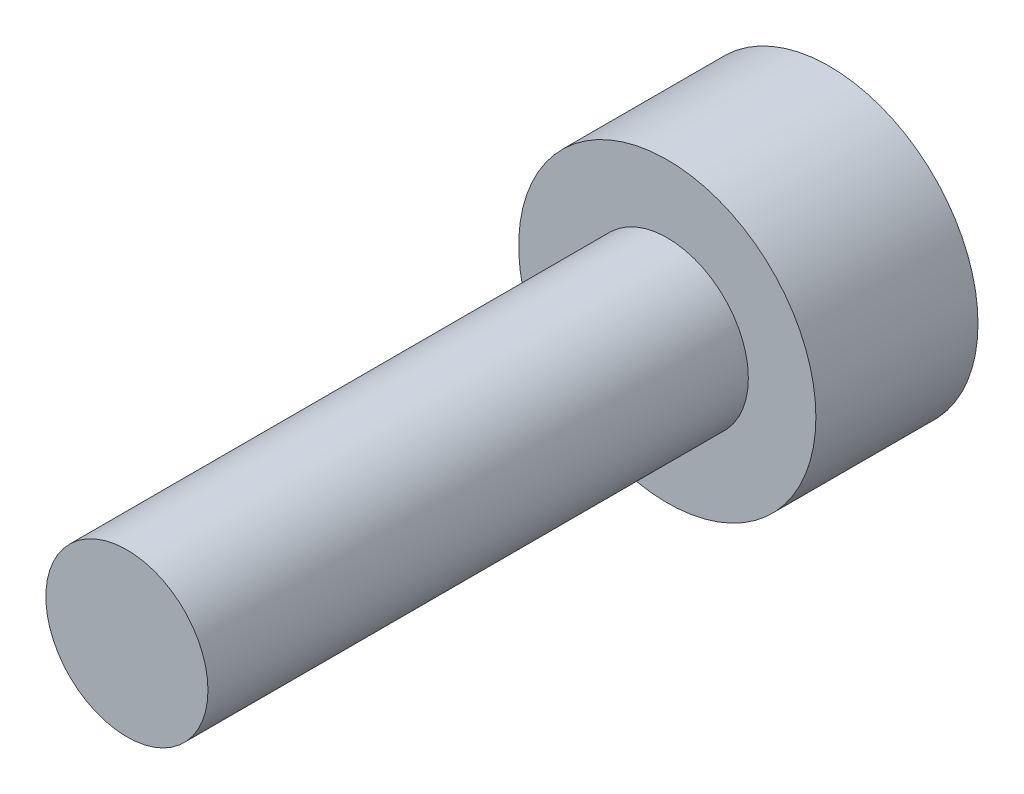
from build123d import *

# Parameters (mm, degrees)
SKETCH_1_R      = 2.75
EXTRUDE_1_DEPTH = 3
SKETCH_2_R      = 1.5
EXTRUDE_2_DEPTH = 10


with BuildPart() as part:
    # 草图1 → 凸台-拉伸1 (new body)
    with BuildSketch(Plane.XY):
        Circle(SKETCH_1_R)
    extrude(amount=EXTRUDE_1_DEPTH)

    # 草图2 → 凸台-拉伸2 (add)
    with BuildSketch(Plane.XY.offset(3)):
        Circle(SKETCH_2_R)
    extrude(amount=EXTRUDE_2_DEPTH)


solid = part.part
